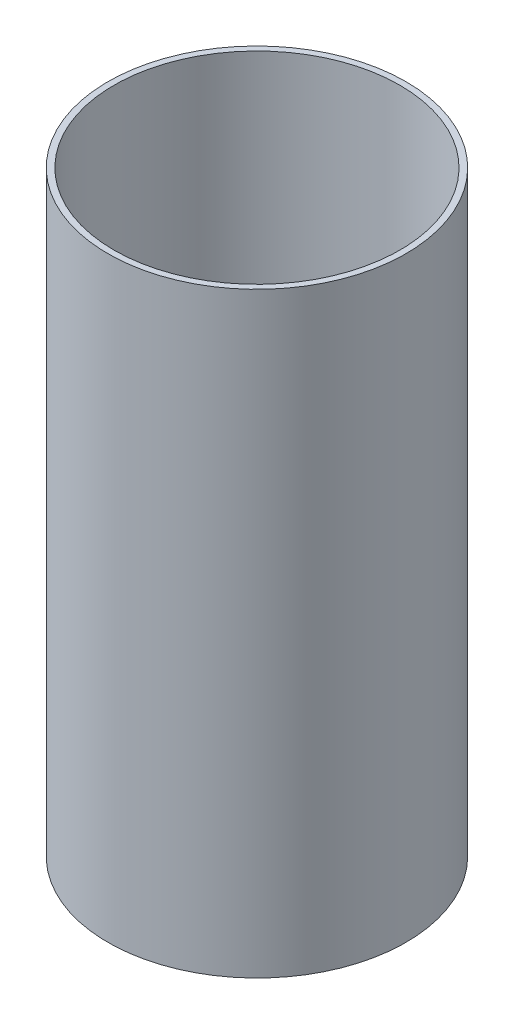
from build123d import *

# Parameters (mm, degrees)
SKETCH1_R           = 38.0746
SKETCH1_R_2         = 36.5125
BOSS_EXTRUDE1_DEPTH = 152.4


with BuildPart() as part:
    # Sketch1 → Boss-Extrude1 (new body)
    with BuildSketch(Plane(origin=(0, 0, 0), x_dir=(1, 0, 0), z_dir=(0, 1, 0))):
        with Locations(Location((0, 0, 0), (0, 0, 90))):
            Circle(SKETCH1_R)
        with Locations(Location((0, 0, 0), (0, 0, 90))):
            Circle(SKETCH1_R_2, mode=Mode.SUBTRACT)
    extrude(amount=BOSS_EXTRUDE1_DEPTH)


solid = part.part
